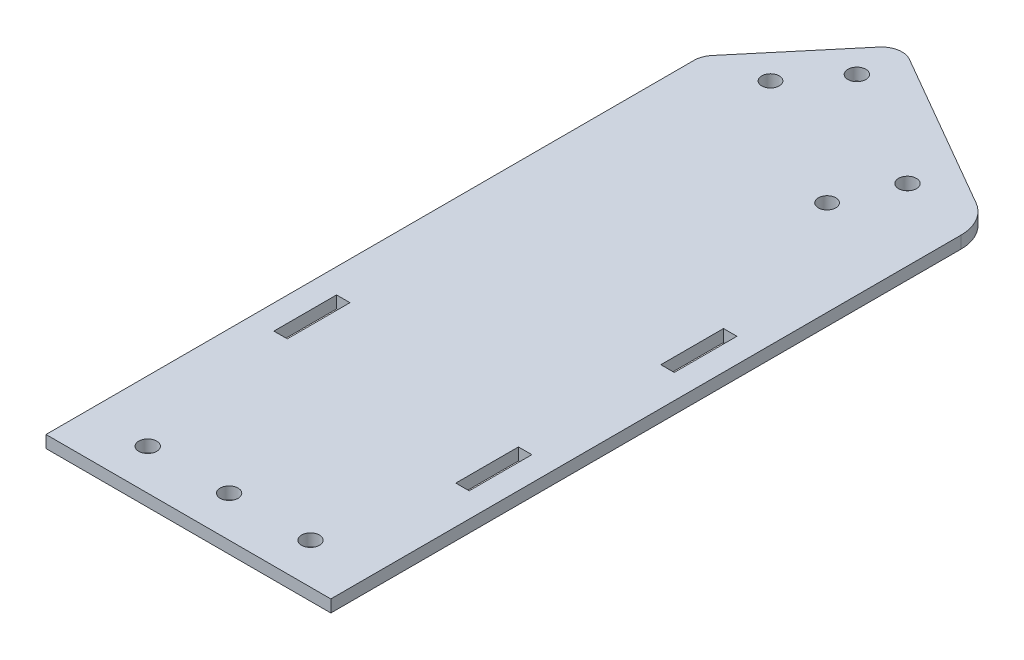
from build123d import *

# Parameters (mm, degrees)
SKETCH_1_W               = 70
SKETCH_1_H               = 160.68
EXTRUDE_1_DEPTH          = 1.5
CUT_EXTRUDE_1_DEPTH      = 126.760303041
CUT_EXTRUDE_1_DEPTH_BACK = 126.760303041
SKETCH_2_R               = 2.2
FILLET_2_R               = 10
CUT_EXTRUDE_2_DEPTH      = 126.760303041
CUT_EXTRUDE_2_DEPTH_BACK = 126.760303041
SKETCH_3_R               = 2.2
CHAMFER_2_SIZE           = 40
CHAMFER_2_SIZE2          = 26.108145787
FILLET_3_R               = 5
CUT_EXTRUDE_3_DEPTH      = 112.92791923
CUT_EXTRUDE_3_DEPTH_BACK = 112.92791923
SKETCH_4_W               = 3.3
SKETCH_4_H               = 15.4
SKETCH_5_R               = 2.15
CUT_EXTRUDE_4_DEPTH      = 10


with BuildPart() as part:
    # 草图1 → 凸台-拉伸1 (new, symmetric)
    with BuildSketch(Plane(origin=(0, 0, 0), x_dir=(1, 0, 0), z_dir=(0, 1, 0))):
        Rectangle(SKETCH_1_W, SKETCH_1_H)
        Polygon((35, 80.34), (-35, 120.754518843), (-35, 80.34), align=None)
    extrude(amount=EXTRUDE_1_DEPTH, both=True)

    # 草图2 → 切除-拉伸1 (cut, two sides: drawn at the far end of the back side and taken through both)
    with BuildSketch(Plane(origin=(0, 1.5, 0), x_dir=(1, 0, 0), z_dir=(0, 1, 0)).offset(-CUT_EXTRUDE_1_DEPTH_BACK)):
        with Locations(Location((-12, 95.928457268, 0), (0, 0, 270))):
            Circle(SKETCH_2_R)
        with Locations(Location((17.444863729, 78.928457268, 0), (0, 0, 270))):
            Circle(SKETCH_2_R)
    extrude(amount=CUT_EXTRUDE_1_DEPTH + CUT_EXTRUDE_1_DEPTH_BACK, mode=Mode.SUBTRACT)

    # 圆角2
    fillet_2_edges = [part.edges().sort_by_distance(p)[0] for p in [
        (35, 0, -80.34),
    ]]
    fillet(fillet_2_edges, radius=FILLET_2_R)

    # 草图3 → 切除-拉伸2 (cut, two sides: drawn at the far end of the back side and taken through both)
    with BuildSketch(Plane(origin=(0, 1.5, 0), x_dir=(1, 0, 0), z_dir=(0, 1, 0)).offset(-CUT_EXTRUDE_2_DEPTH_BACK)):
        with Locations(Location((0, -70.34, 0), (0, 0, 270))):
            Circle(SKETCH_3_R)
        with Locations(Location((-20, -70.34, 0), (0, 0, 270))):
            Circle(SKETCH_3_R)
        with Locations(Location((20, -70.34, 0), (0, 0, 270))):
            Circle(SKETCH_3_R)
    extrude(amount=CUT_EXTRUDE_2_DEPTH + CUT_EXTRUDE_2_DEPTH_BACK, mode=Mode.SUBTRACT)

    # 倒角2
    chamfer_2_edges = [part.edges().sort_by_distance(p)[0] for p in [
        (-35, 0, -120.754518843),
    ]]
    chamfer_2_side = [part.faces().sort_by_distance(p)[0] for p in [
        (-35, 0, -20.207259422),
    ]]
    chamfer(chamfer_2_edges, length=CHAMFER_2_SIZE, length2=CHAMFER_2_SIZE2, reference=chamfer_2_side[0])

    # 圆角3
    fillet_3_edges = [part.edges().sort_by_distance(p)[0] for p in [
        (-35, 0, -80.754518843),
        (-12.389682503, 0, -107.70044595),
    ]]
    fillet(fillet_3_edges, radius=FILLET_3_R)

    # 草图4 → 切除-拉伸3 (cut, two sides: drawn at the far end of the back side and taken through both)
    with BuildSketch(Plane(origin=(0, 1.5, 0), x_dir=(1, 0, 0), z_dir=(0, 1, 0)).offset(-CUT_EXTRUDE_3_DEPTH_BACK)):
        with Locations((-27.35, -22.64)):
            Rectangle(SKETCH_4_W, SKETCH_4_H)
        with Locations((27.35, -32.64)):
            Rectangle(SKETCH_4_W, SKETCH_4_H)
        with Locations((27.35, 17.76)):
            Rectangle(SKETCH_4_W, SKETCH_4_H)
    extrude(amount=CUT_EXTRUDE_3_DEPTH + CUT_EXTRUDE_3_DEPTH_BACK, mode=Mode.SUBTRACT)

    # 草图5 → 切除-拉伸4 (cut)
    with BuildSketch(Plane(origin=(0, 1.5, 0), x_dir=(1, 0, 0), z_dir=(0, 1, 0))):
        with Locations(Location((-21.232050808, 83.938076211, 0), (0, 0, 270))):
            Circle(SKETCH_5_R)
        with Locations(Location((11.676914536, 64.938076211, 0), (0, 0, 270))):
            Circle(SKETCH_5_R)
    extrude(amount=-CUT_EXTRUDE_4_DEPTH, mode=Mode.SUBTRACT)


solid = part.part
